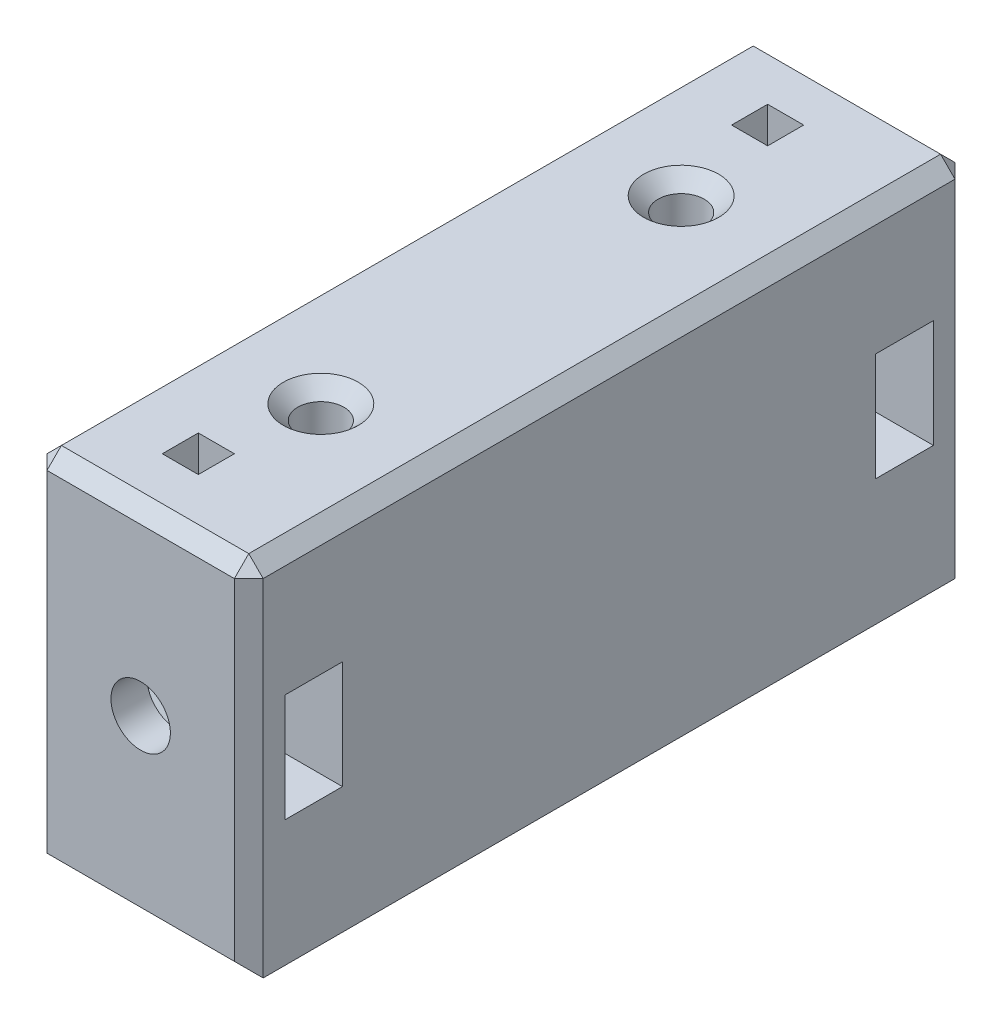
from build123d import *

# Parameters (mm, degrees)
SKETCH1_W               = 50
SKETCH1_H               = 100
BOSS_EXTRUDE1_DEPTH     = 30
CUT_EXTRUDE1_DEPTH      = 77.811457479
CUT_EXTRUDE1_DEPTH_BACK = 77.811457479
SKETCH2_R               = 3.2
CHAMFER1_SIZE           = 2
CUT_EXTRUDE2_START      = -5
SKETCH3_W               = 2.292640227
SKETCH3_H               = 15
CUT_EXTRUDE2_DEPTH      = 8
SKETCH4_R               = 4.125
CUT_EXTRUDE3_DEPTH      = 8
SKETCH6_W               = 5
SKETCH6_H               = 5
CUT_EXTRUDE4_DEPTH      = 67.755149614


with BuildPart() as part:
    # Sketch1 → Boss-Extrude1 (new body)
    with BuildSketch(Plane.YZ):
        Rectangle(SKETCH1_W, SKETCH1_H)
    extrude(amount=BOSS_EXTRUDE1_DEPTH)

    # Sketch2 → Cut-Extrude1 (cut, two sides: drawn at the far end of the back side and taken through both)
    with BuildSketch(Plane(origin=(0, 25, 0), x_dir=(-1, 0, 0), z_dir=(0, 1, 0)).offset(-CUT_EXTRUDE1_DEPTH_BACK)):
        with Locations(Location((-15, -25, 0), (0, 0, 90))):
            Circle(SKETCH2_R)
        with Locations(Location((-15, 25, 0), (0, 0, 270))):
            Circle(SKETCH2_R)
    extrude(amount=CUT_EXTRUDE1_DEPTH + CUT_EXTRUDE1_DEPTH_BACK, mode=Mode.SUBTRACT)

    # Chamfer1
    chamfer1_edges = [part.edges().sort_by_distance(p)[0] for p in [
        (15, 25, 50),
        (15, -25, 50),
        (0, 0, 50),
        (30, 0, 50),
        (15, 25, -50),
        (0, 25, 0),
        (30, 25, 0),
        (15, 25, -28.2),
        (15, 25, 28.2),
        (15, -25, -50),
        (15, -25, 28.2),
        (15, -25, -28.2),
        (0, 0, -50),
        (30, 0, -50),
    ]]
    chamfer(chamfer1_edges, length=CHAMFER1_SIZE)

    # Sketch3 → Cut-Extrude2 (cut)
    with BuildSketch(Plane.XY.offset(50).offset(CUT_EXTRUDE2_START)):
        Polygon((15, 7.5), (21.495190528, 3.75), (21.495190528, -3.75), (15, -7.5), (28, -7.5), (28, 7.5), align=None)
        with Locations((29.146320114, 0)):
            Rectangle(SKETCH3_W, SKETCH3_H)
        Polygon((15, -7.5), (21.495190528, -3.75), (21.495190528, 3.75), (15, 7.5), (8.504809472, 3.75), (8.504809472, -3.75), align=None)
    cut_extrude2 = extrude(amount=-CUT_EXTRUDE2_DEPTH, mode=Mode.SUBTRACT)

    # Sketch4 → Cut-Extrude3 (cut)
    with BuildSketch(Plane.XY.offset(50)):
        with Locations((15, 0)):
            Circle(SKETCH4_R)
    cut_extrude3 = extrude(amount=-CUT_EXTRUDE3_DEPTH, mode=Mode.SUBTRACT)

    # Sketch6 → Cut-Extrude4 (cut, symmetric)
    with BuildSketch(Plane.XZ.offset(-7.5)):
        with Locations((12.5, 39.5)):
            Rectangle(SKETCH6_W, SKETCH6_H)
    cut_extrude4 = extrude(amount=CUT_EXTRUDE4_DEPTH, both=True, mode=Mode.SUBTRACT)

    # Mirror1: Cut-Extrude2, Cut-Extrude3, Cut-Extrude4 across plane
    add(cut_extrude2.mirror(Plane.XY), mode=Mode.SUBTRACT)
    add(cut_extrude3.mirror(Plane.XY), mode=Mode.SUBTRACT)
    add(cut_extrude4.mirror(Plane.XY), mode=Mode.SUBTRACT)


solid = part.part
